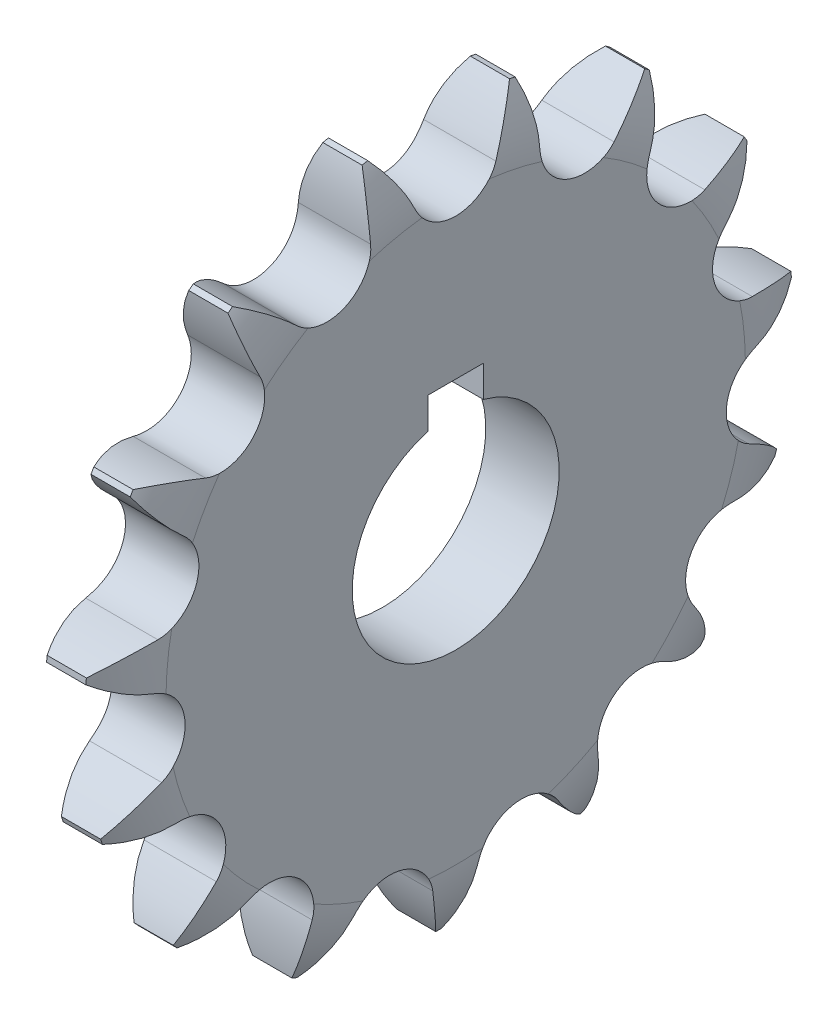
from build123d import *

# Parameters (mm, degrees)
TOOTHCUT_DEPTH      = 37.710811315
TEETHCUTS_COUNT     = 15
TEETHCUTS_ANGLE     = 336
BORSKE_R            = 5
BORE_DEPTH          = 50.0005
SKETCH1_R           = 15
SKETCH1_R_2         = 7.5
BOSS_EXTRUDE1_DEPTH = 24.6804
CUT_EXTRUDE2_START  = -18.5
SKETCH3_R           = 7.5
CUT_EXTRUDE2_DEPTH  = 18.5
SKETCH2_R           = 17.797607849
CUT_EXTRUDE1_DEPTH  = 24.6804
SKETCH5_W           = 4
SKETCH5_H           = 4
CUT_EXTRUDE5_DEPTH  = 37.627036963


with BuildPart() as part:
    # BasProSke → Base-Revolve (revolve)
    with BuildSketch(Plane(origin=(0, 0, 0), x_dir=(1, 0, 0), z_dir=(0, 1, 0)), mode=Mode.PRIVATE) as base_revolve_sk:
        with BuildLine():
            Line((0, 0), (0, 20.988608354))
            ThreePointArc((0, 20.988608354), (0.314698702, 23.416771239), (1.238, 25.684484843))
            Line((1.238, 25.684484843), (4.0816, 25.684484843))
            ThreePointArc((4.0816, 25.684484843), (5.004901298, 23.416771239), (5.3196, 20.988608354))
            Line((5.3196, 20.988608354), (5.3196, 0))
            Line((5.3196, 0), (0, 0))
        make_face()
    revolve(base_revolve_sk.sketch.rotate(Axis((-10, 0, 0), (1, 0, 0)), 180), axis=Axis((-10, 0, 0), (1, 0, 0)))

    # TooCutSke → ToothCut (cut, through all)
    with BuildSketch(Plane(origin=(0, 0, 0), x_dir=(0, 0, -1), z_dir=(1, 0, 0))):
        with BuildLine():
            ThreePointArc((2.951828939, 21.685132796), (4.063020217, 23.756940993), (5.530366998, 25.593793922))
            ThreePointArc((5.530366998, 25.593793922), (0, 26.184484843), (-5.530366998, 25.593793922))
            ThreePointArc((-5.530366998, 25.593793922), (-4.063020217, 23.756940993), (-2.951828939, 21.685132796))
            ThreePointArc((-2.951828939, 21.685132796), (0, 19.731359843), (2.951828939, 21.685132796))
        make_face()
    toothcut = extrude(amount=TOOTHCUT_DEPTH, mode=Mode.SUBTRACT)

    # TeethCuts: ToothCut ×15 about axis
    teethcuts_axis = Axis((-10, 0, 0), (1, 0, 0))
    for i in range(1, TEETHCUTS_COUNT):
        add(toothcut.rotate(teethcuts_axis, i * TEETHCUTS_ANGLE / (TEETHCUTS_COUNT - 1)), mode=Mode.SUBTRACT)

    # BorSke → Bore (cut, symmetric)
    with BuildSketch(Plane(origin=(0, 0, 0), x_dir=(0, 0, -1), z_dir=(1, 0, 0))):
        with Locations(Location((0, 0, 0), (0, 0, 180))):
            Circle(BORSKE_R)
    extrude(amount=BORE_DEPTH, both=True, mode=Mode.SUBTRACT)

    # Sketch1 → Boss-Extrude1 (add)
    with BuildSketch(Plane(origin=(5.3196, 0, 0), x_dir=(0, 0, -1), z_dir=(1, 0, 0))):
        with Locations(Location((0, 0, 0), (0, 0, 180))):
            Circle(SKETCH1_R)
        Circle(SKETCH1_R_2, mode=Mode.SUBTRACT)
    extrude(amount=BOSS_EXTRUDE1_DEPTH)

    # Sketch3 → Cut-Extrude2 (cut)
    with BuildSketch(Plane(origin=(5.3196, 0, 0), x_dir=(0, 0, -1), z_dir=(1, 0, 0)).offset(CUT_EXTRUDE2_START)):
        Circle(SKETCH3_R)
    extrude(amount=CUT_EXTRUDE2_DEPTH, mode=Mode.SUBTRACT)

    # Sketch2 → Cut-Extrude1 (cut)
    with BuildSketch(Plane(origin=(30, 0, 0), x_dir=(0, 0, -1), z_dir=(1, 0, 0))):
        Circle(SKETCH2_R)
    extrude(amount=-CUT_EXTRUDE1_DEPTH, mode=Mode.SUBTRACT)

    # Sketch5 → Cut-Extrude5 (cut, through all)
    with BuildSketch(Plane(origin=(5.3196, 0, 0), x_dir=(0, 0, -1), z_dir=(1, 0, 0))):
        with Locations((0, 7.5)):
            Rectangle(SKETCH5_W, SKETCH5_H)
    extrude(amount=-CUT_EXTRUDE5_DEPTH, mode=Mode.SUBTRACT)


solid = part.part
